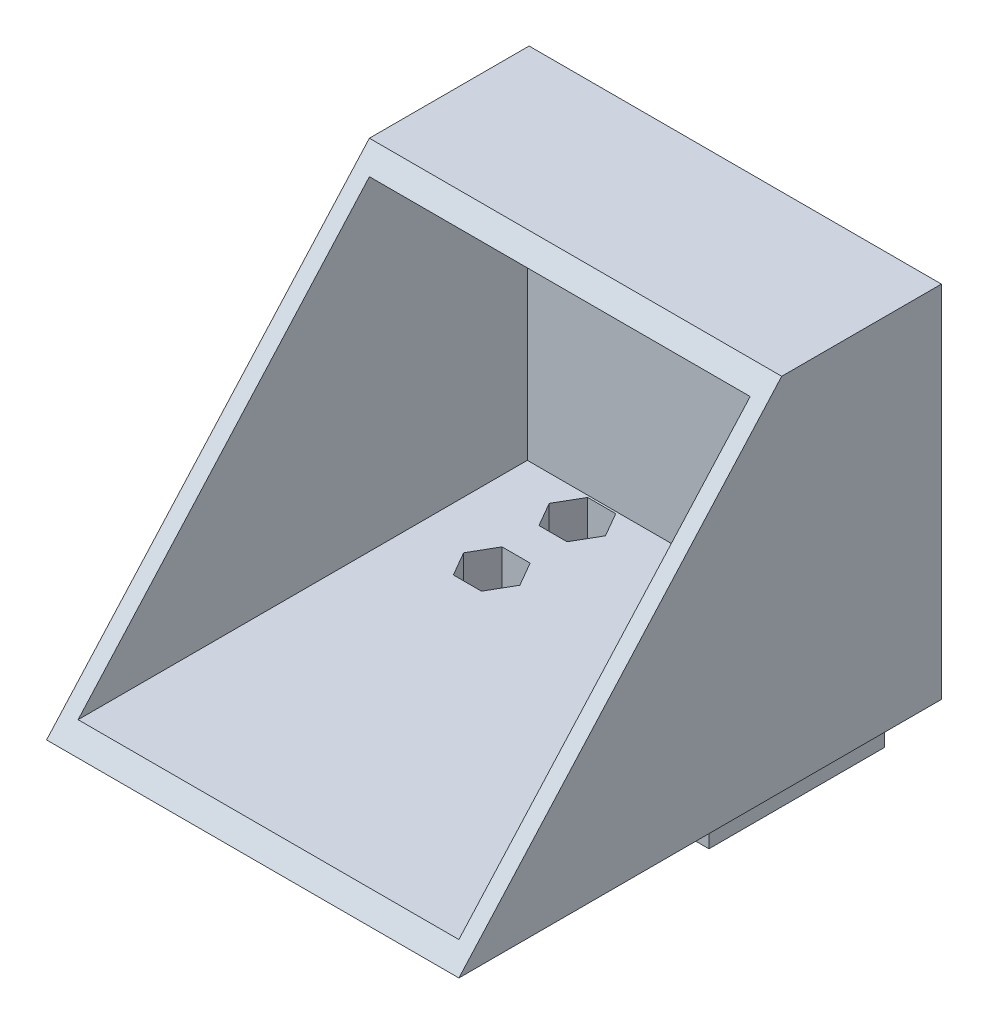
from build123d import *

# Parameters (mm, degrees)
EXTRUDE_1_DEPTH             = 43.4
EXTRUDE_2_DEPTH             = 1.8
CUT_EXTRUDE_1_DEPTH         = 43.4
EXTRUDE_3_DEPTH             = 43.4
EXTRUDE_4_DEPTH             = 16.205128205
SKETCH_6_W                  = 45.2
SKETCH_6_H                  = 41
EXTRUDE_5_DEPTH             = 2
SKETCH_7_W                  = 34
SKETCH_7_H                  = 20
EXTRUDE_6_DEPTH             = 8
EXTRUDE_7_DEPTH             = 1.8
HOLE_WIZARD_3_3_3_3_2_D     = 3.3
HOLE_WIZARD_3_3_3_3_2_DEPTH = 10
HOLE_WIZARD_16_0_16_1_D     = 16
HOLE_WIZARD_16_0_16_1_DEPTH = 55
SKETCH_19_R                 = 1.65
CUT_EXTRUDE_6_DEPTH         = 5


with BuildPart() as part:
    # 草图1 → 凸台-拉伸1 (new body)
    with BuildSketch(Plane(origin=(21.7, 0, 0), x_dir=(0, 0, -1), z_dir=(1, 0, 0))):
        Polygon((-18.205128205, 8), (-18.205128205, 49), (-55, 8), align=None)
    extrude(amount=-EXTRUDE_1_DEPTH)

    # 草图2 → 凸台-拉伸2 (add)
    with BuildSketch(Plane.ZY.offset(21.7)):
        Polygon((18.205128205, 8), (18.205128205, 49), (55, 8), align=None)
    extrude(amount=EXTRUDE_2_DEPTH)

    # 草图3 → 切除-拉伸1 (cut)
    with BuildSketch(Plane(origin=(21.7, 0, 0), x_dir=(0, 0, -1), z_dir=(1, 0, 0))):
        Polygon((-18.205128205, 8), (-18.205128205, 47), (-20, 47), (-55, 8), align=None)
    extrude(amount=-CUT_EXTRUDE_1_DEPTH, mode=Mode.SUBTRACT)

    # 草图4 → 凸台-拉伸3 (add)
    with BuildSketch(Plane(origin=(-21.7, 0, 0), x_dir=(0, 0, -1), z_dir=(1, 0, 0))):
        Polygon((-18.205128205, 10), (-18.205128205, 8), (-55, 8), (-53.205128205, 10), align=None)
    extrude(amount=EXTRUDE_3_DEPTH)

    # 草图5 → 凸台-拉伸4 (add)
    with BuildSketch(Plane(origin=(0, 0, 18.205128205), x_dir=(-1, 0, 0), z_dir=(0, 0, -1))):
        Polygon((21.7, 10), (21.7, 47), (-21.7, 47), (-21.7, 49), (23.5, 49), (23.5, 8), (-21.7, 8), (-21.7, 10), align=None)
    extrude(amount=EXTRUDE_4_DEPTH)

    # 草图6 → 凸台-拉伸5 (add)
    with BuildSketch(Plane(origin=(0, 0, 2), x_dir=(-1, 0, 0), z_dir=(0, 0, -1))):
        with Locations((0.9, 28.5)):
            Rectangle(SKETCH_6_W, SKETCH_6_H)
    extrude(amount=EXTRUDE_5_DEPTH)

    # 草图7 → 凸台-拉伸6 (add)
    with BuildSketch(Plane.XZ.offset(-8)):
        with Locations((0, 10)):
            Rectangle(SKETCH_7_W, SKETCH_7_H)
    extrude(amount=EXTRUDE_6_DEPTH)

    # 草图10 → 凸台-拉伸7 (add)
    with BuildSketch(Plane(origin=(21.7, 0, 0), x_dir=(0, 0, -1), z_dir=(1, 0, 0))):
        Polygon((0, 49), (0, 8), (-55, 8), (-18.205128205, 49), align=None)
    extrude(amount=EXTRUDE_7_DEPTH)

    # Ø3.3 (3.3) 直径孔2
    with Locations(Plane(origin=(0, 0, 0), x_dir=(-1, 0, 0), z_dir=(0, -1, 0))):
        with Locations((13, -5), (13, -14.75698348)):
            hole_wizard_3_3_3_3_2 = Hole(HOLE_WIZARD_3_3_3_3_2_D / 2, depth=HOLE_WIZARD_3_3_3_3_2_DEPTH)

    # Ø16.0 (16) 直径孔1
    with Locations(Plane(origin=(0, 0, 0), x_dir=(-1, 0, 0), z_dir=(0, 0, -1))):
        with Locations((0, 0)):
            Hole(HOLE_WIZARD_16_0_16_1_D / 2, depth=HOLE_WIZARD_16_0_16_1_DEPTH)

    # 草图19 → 切除-拉伸6 (cut)
    # profile 1 of 2: a face of its own
    with BuildSketch(Plane(origin=(0, 10, 0), x_dir=(1, 0, 0), z_dir=(0, 1, 0))):
        Polygon((-9.795706006, -14.75698348), (-11.397853003, -11.98198348), (-14.602146997, -11.98198348), (-16.204293994, -14.75698348), (-14.602146997, -17.53198348), (-11.397853003, -17.53198348), align=None)
        with Locations(Location((-13, -14.75698348, 0), (0, 0, 90))):
            Circle(SKETCH_19_R, mode=Mode.SUBTRACT)
    # profile 2 of 2: a face of its own
    with BuildSketch(Plane(origin=(0, 10, 0), x_dir=(1, 0, 0), z_dir=(0, 1, 0))):
        Polygon((-9.795706006, -5), (-11.397853003, -2.225), (-14.602146997, -2.225), (-16.204293994, -5), (-14.602146997, -7.775), (-11.397853003, -7.775), align=None)
        with Locations(Location((-13, -5, 0), (0, 0, 90))):
            Circle(SKETCH_19_R, mode=Mode.SUBTRACT)
    cut_extrude_6 = extrude(amount=-CUT_EXTRUDE_6_DEPTH, mode=Mode.SUBTRACT)

    # 镜向1: Ø3.3 (3.3) 直径孔2, 切除-拉伸6 across plane
    add(hole_wizard_3_3_3_3_2.mirror(Plane.ZY), mode=Mode.SUBTRACT)
    add(cut_extrude_6.mirror(Plane.ZY), mode=Mode.SUBTRACT)


solid = part.part
